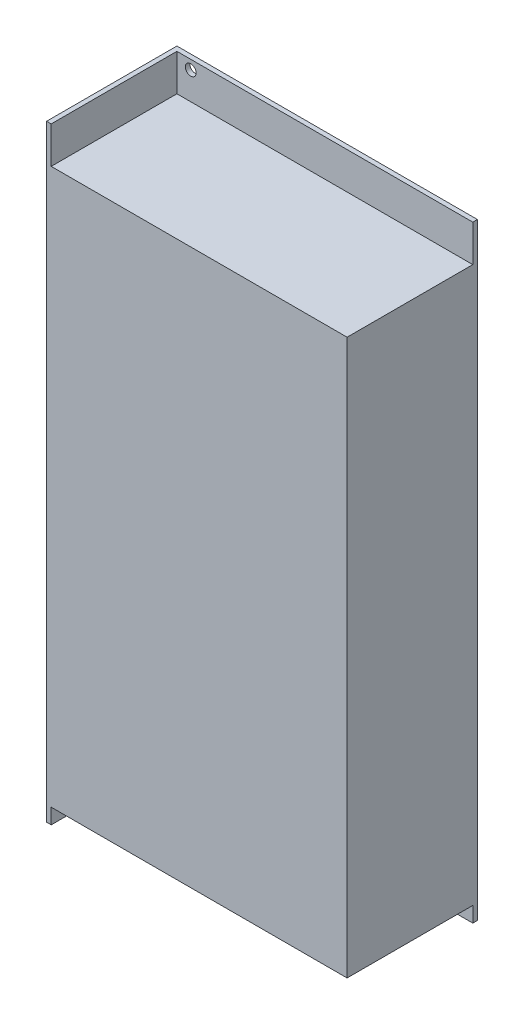
from build123d import *

# Parameters (mm, degrees)
ESQUISSE1_R        = 1.75
BOSS_EXTRU_1_DEPTH = 1.5
ESQUISSE2_W        = 96.5
ESQUISSE2_H        = 181
BOSS_EXTRU_2_DEPTH = 41


with BuildPart() as part:
    # Esquisse1 → Boss.-Extru.1 (new body)
    with BuildSketch(Plane.XY):
        with BuildLine():
            ThreePointArc((-8.5, -195.25), (-6.75, -193.5), (-5, -195.25))
            Line((-5, -195.25), (-5, -198))
            Line((-5, -198), (0, -198))
            Line((0, -198), (0, 0))
            Line((0, 0), (-98, 0))
            Line((-98, 0), (-98, -198))
            Line((-98, -198), (-8.5, -198))
            Line((-8.5, -198), (-8.5, -195.25))
        make_face()
        with Locations((-92, -3)):
            Circle(ESQUISSE1_R, mode=Mode.SUBTRACT)
    extrude(amount=BOSS_EXTRU_1_DEPTH)

    # Esquisse2 → Boss.-Extru.2 (add)
    with BuildSketch(Plane.XY.offset(1.5)):
        with Locations((-48.25, -102.5)):
            Rectangle(ESQUISSE2_W, ESQUISSE2_H)
        Polygon((-98, 0), (-98, -198), (-96.5, -198), (-96.5, -193), (-96.5, -12), (-96.5, 0), align=None)
    extrude(amount=BOSS_EXTRU_2_DEPTH)


solid = part.part
